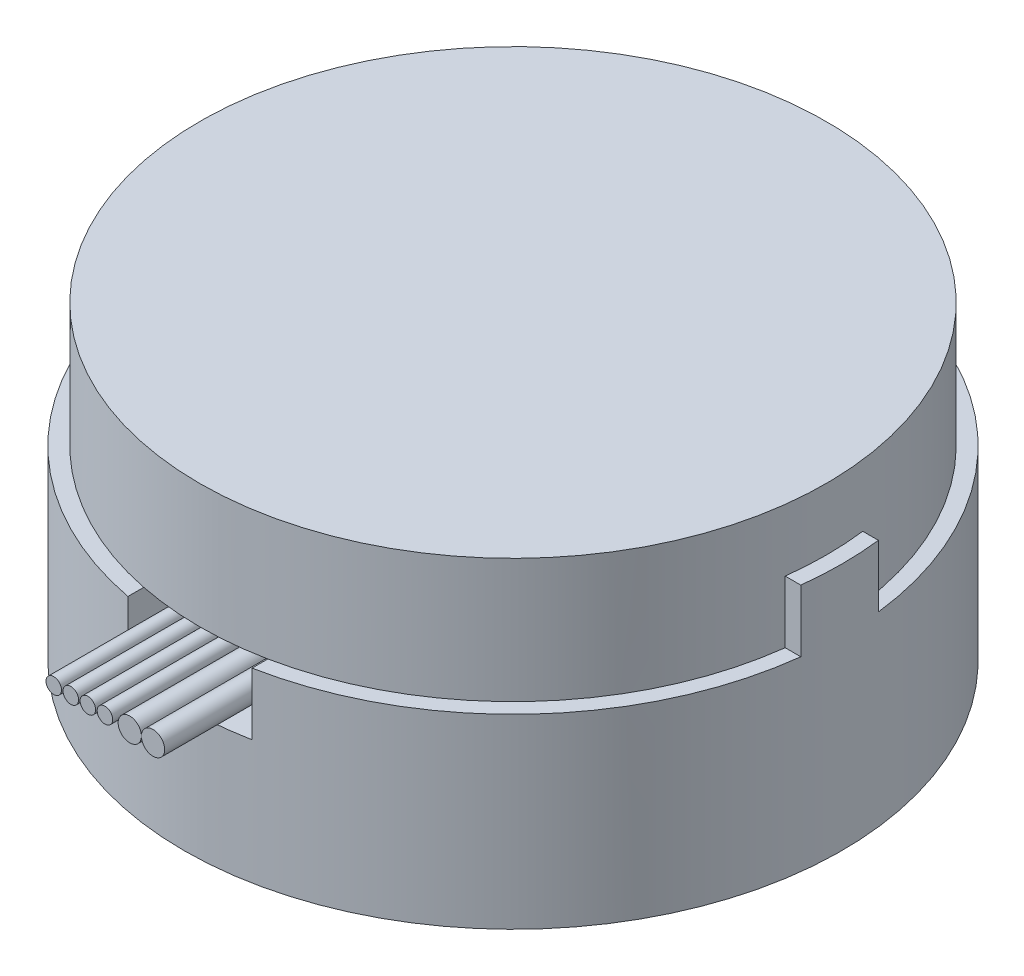
from build123d import *

# Parameters (mm, degrees)
SKETCH1_R             = 21.2
BOSS_EXTRUDE1_DEPTH   = 20
SKETCH2_OUTSIDE_W     = 57.042
SKETCH2_OUTSIDE_H     = 57.042
SKETCH2_OUTSIDE_R     = 20.2
CUT_EXTRUDE1_DEPTH    = 4
SKETCH3_OUTSIDE_W     = 57.042
SKETCH3_OUTSIDE_H     = 57.042
CUT_EXTRUDE2_DEPTH    = 4
SKETCH4_W             = 8
SKETCH4_H             = 4
CUT_EXTRUDE3_DEPTH    = 5
SKETCH5_R             = 0.75
BOSS_EXTRUDE3_DEPTH   = 10
BOSS_EXTRUDE3_2_DEPTH = 10
SKETCH5_R_2           = 0.5
BOSS_EXTRUDE3_3_DEPTH = 10
BOSS_EXTRUDE3_4_DEPTH = 10
BOSS_EXTRUDE3_5_DEPTH = 10
BOSS_EXTRUDE3_6_DEPTH = 10


with BuildPart() as part:
    # Sketch1 → Boss-Extrude1 (new body)
    with BuildSketch(Plane(origin=(0, 0, 0), x_dir=(1, 0, 0), z_dir=(0, 1, 0))):
        with Locations(Location((0, 0, 0), (0, 0, 270))):
            Circle(SKETCH1_R)
    extrude(amount=BOSS_EXTRUDE1_DEPTH)

    # Sketch2 outside → Cut-Extrude1 (cut)
    with BuildSketch(Plane(origin=(0, 20, 0), x_dir=(1, 0, 0), z_dir=(0, 1, 0))):
        Rectangle(SKETCH2_OUTSIDE_W, SKETCH2_OUTSIDE_H)
        with Locations(Location((0, 0, 0), (0, 0, 270))):
            Circle(SKETCH2_OUTSIDE_R, mode=Mode.SUBTRACT)
    extrude(amount=-CUT_EXTRUDE1_DEPTH, mode=Mode.SUBTRACT)

    # Sketch3 outside → Cut-Extrude2 (cut)
    with BuildSketch(Plane(origin=(0, 16, 0), x_dir=(1, 0, 0), z_dir=(0, 1, 0))):
        Rectangle(SKETCH3_OUTSIDE_W, SKETCH3_OUTSIDE_H)
        with BuildLine():
            Line((20.044700048, 2.5), (23.037339055, 2.5))
            Line((23.037339055, 2.5), (23.037339055, -2.5))
            Line((23.037339055, -2.5), (20.044700048, -2.5))
            ThreePointArc((20.044700048, -2.5), (0, -20.2), (-20.044700048, -2.5))
            Line((-20.044700048, -2.5), (-23.037339055, -2.5))
            Line((-23.037339055, -2.5), (-23.037339055, 2.5))
            Line((-23.037339055, 2.5), (-20.044700048, 2.5))
            ThreePointArc((-20.044700048, 2.5), (0, 20.2), (20.044700048, 2.5))
        make_face(mode=Mode.SUBTRACT)
    extrude(amount=-CUT_EXTRUDE2_DEPTH, mode=Mode.SUBTRACT)

    # Sketch4 → Cut-Extrude3 (cut)
    with BuildSketch(Plane.XY.offset(21.2)):
        with Locations((0, 10)):
            Rectangle(SKETCH4_W, SKETCH4_H)
    extrude(amount=-CUT_EXTRUDE3_DEPTH, mode=Mode.SUBTRACT)


with BuildPart() as body_2:
    # Sketch5 → Boss-Extrude3 (new body)
    with BuildSketch(Plane.XY.offset(16.2)):
        with Locations((3, 10.017134532)):
            Circle(SKETCH5_R)
    extrude(amount=BOSS_EXTRUDE3_DEPTH)


with BuildPart() as body_3:
    # Sketch5 → Boss-Extrude3 2 (new body)
    with BuildSketch(Plane.XY.offset(16.2)):
        with Locations((1.5, 10.017134532)):
            Circle(SKETCH5_R)
    extrude(amount=BOSS_EXTRUDE3_2_DEPTH)


with BuildPart() as body_4:
    # Sketch5 → Boss-Extrude3 3 (new body)
    with BuildSketch(Plane.XY.offset(16.2)):
        with Locations((-3.4, 10.017134532)):
            Circle(SKETCH5_R_2)
    extrude(amount=BOSS_EXTRUDE3_3_DEPTH)


with BuildPart() as body_5:
    # Sketch5 → Boss-Extrude3 4 (new body)
    with BuildSketch(Plane.XY.offset(16.2)):
        with Locations((-2.3, 10.017134532)):
            Circle(SKETCH5_R_2)
    extrude(amount=BOSS_EXTRUDE3_4_DEPTH)


with BuildPart() as body_6:
    # Sketch5 → Boss-Extrude3 5 (new body)
    with BuildSketch(Plane.XY.offset(16.2)):
        with Locations((-1.2, 10.017134532)):
            Circle(SKETCH5_R_2)
    extrude(amount=BOSS_EXTRUDE3_5_DEPTH)


with BuildPart() as body_7:
    # Sketch5 → Boss-Extrude3 6 (new body)
    with BuildSketch(Plane.XY.offset(16.2)):
        with Locations((-0.1, 10.017134532)):
            Circle(SKETCH5_R_2)
    extrude(amount=BOSS_EXTRUDE3_6_DEPTH)


solid = Compound([part.part, body_2.part, body_3.part, body_4.part, body_5.part, body_6.part, body_7.part])
